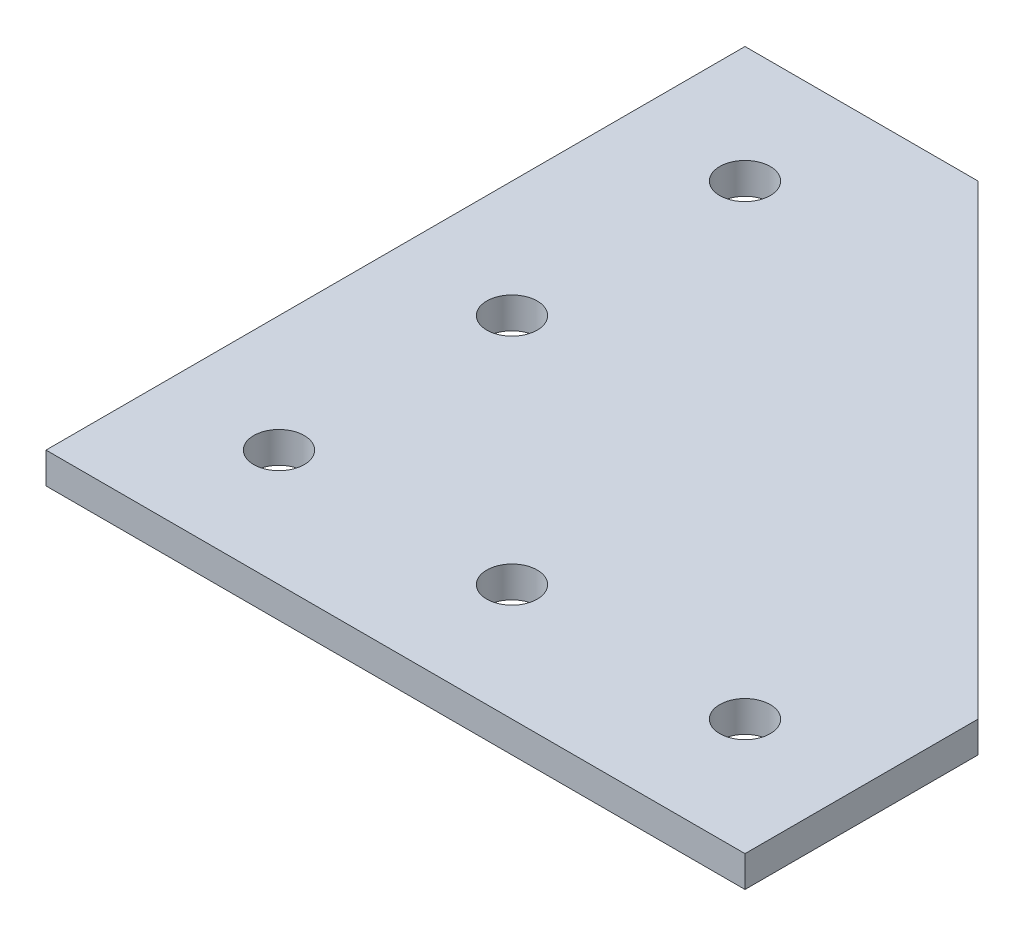
from build123d import *

# Parameters (mm, degrees)
BOSS_EXTRUDE1_DEPTH = 4
SKETCH2_R           = 3.25
CUT_EXTRUDE1_DEPTH  = 128.342059038


with BuildPart() as part:
    # Sketch1 → Boss-Extrude1 (new body)
    with BuildSketch(Plane(origin=(0, 0, 0), x_dir=(1, 0, 0), z_dir=(0, 1, 0))):
        Polygon((0, 0), (90, 0), (90, 30), (30, 90), (0, 90), align=None)
    extrude(amount=BOSS_EXTRUDE1_DEPTH)

    # Sketch2 → Cut-Extrude1 (cut, through all)
    with BuildSketch(Plane(origin=(0, 4, 0), x_dir=(1, 0, 0), z_dir=(0, 1, 0))):
        with Locations(Location((15, 15, 0), (0, 0, 270))):
            Circle(SKETCH2_R)
        with Locations(Location((45, 15, 0), (0, 0, 270))):
            Circle(SKETCH2_R)
        with Locations(Location((75, 15, 0), (0, 0, 270))):
            Circle(SKETCH2_R)
        with Locations(Location((15, 45, 0), (0, 0, 270))):
            Circle(SKETCH2_R)
        with Locations(Location((15, 75, 0), (0, 0, 270))):
            Circle(SKETCH2_R)
    extrude(amount=-CUT_EXTRUDE1_DEPTH, mode=Mode.SUBTRACT)


solid = part.part
